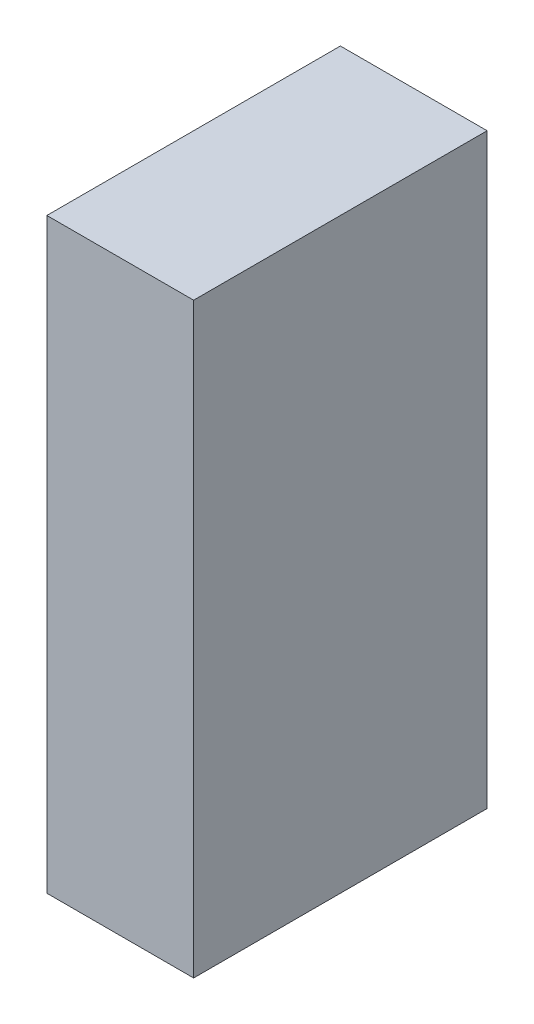
from build123d import *

# Parameters (mm, degrees)
SKETCH2_W           = 25.4
SKETCH2_H           = 101.6
BOSS_EXTRUDE1_DEPTH = 25.4


with BuildPart() as part:
    # Sketch2 → Boss-Extrude1 (new, symmetric)
    with BuildSketch(Plane.XY):
        Rectangle(SKETCH2_W, SKETCH2_H)
    extrude(amount=BOSS_EXTRUDE1_DEPTH, both=True)


solid = part.part
